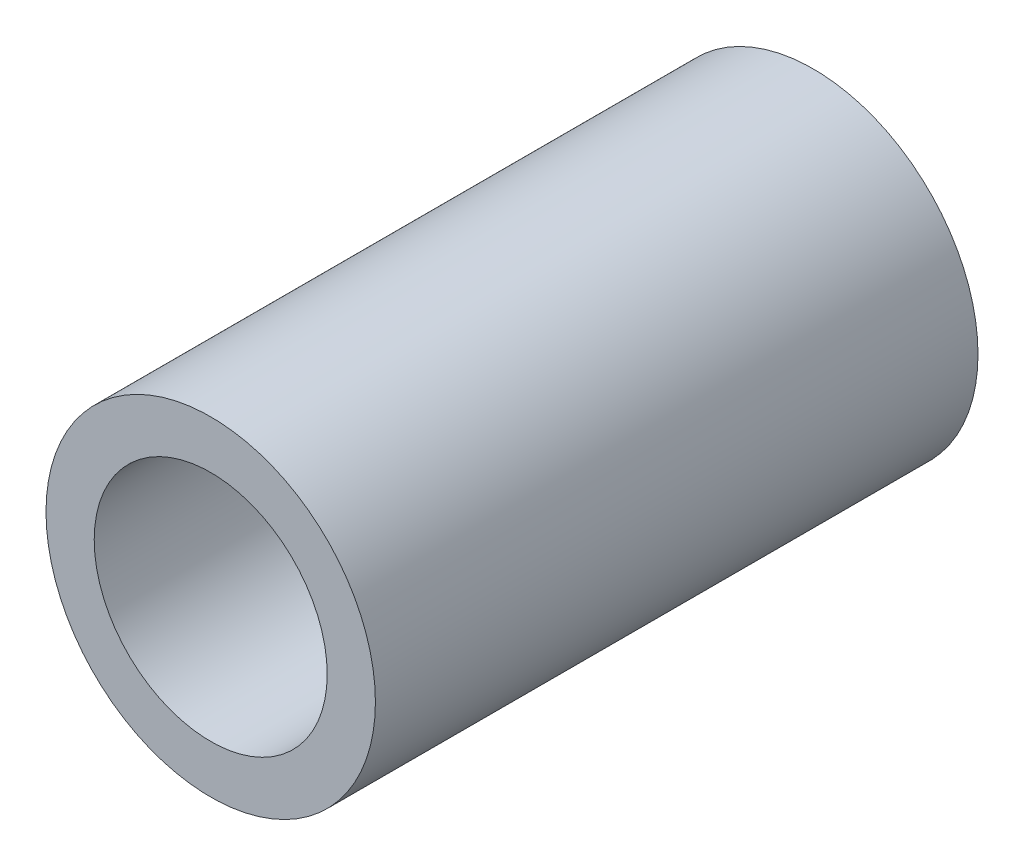
from build123d import *

# Parameters (mm, degrees)
SKETCH1_R           = 2.05
SKETCH1_R_2         = 1.45
BOSS_EXTRUDE1_DEPTH = 7.5


with BuildPart() as part:
    # Sketch1 → Boss-Extrude1 (new body)
    with BuildSketch(Plane.XY):
        Circle(SKETCH1_R)
        Circle(SKETCH1_R_2, mode=Mode.SUBTRACT)
    extrude(amount=BOSS_EXTRUDE1_DEPTH)


solid = part.part
